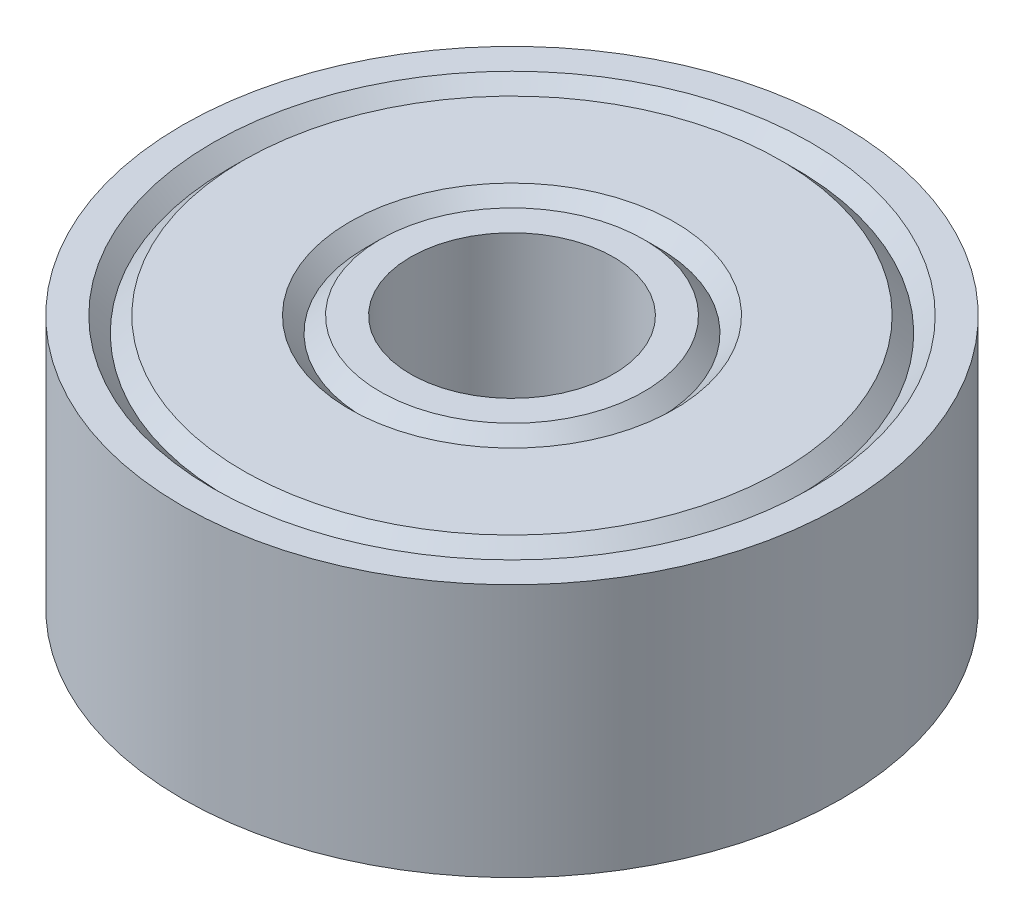
from build123d import *


with BuildPart() as part:
    # Sketch1 → Revolve1 (revolve)
    with BuildSketch(Plane.XY):
        Polygon((-2, 2.5), (-2.6, 2.5), (-2.9, 2.2), (-3.2, 2.5), (-5.3, 2.5), (-5.6, 2.2), (-5.9, 2.5), (-6.5, 2.5), (-6.5, -2.5), (-5.9, -2.5), (-5.6, -2.2), (-5.3, -2.5), (-3.2, -2.5), (-2.9, -2.2), (-2.6, -2.5), (-2, -2.5), align=None)
    revolve(axis=Axis((0, 2.5, 0), (0, -1, 0)))


solid = part.part
